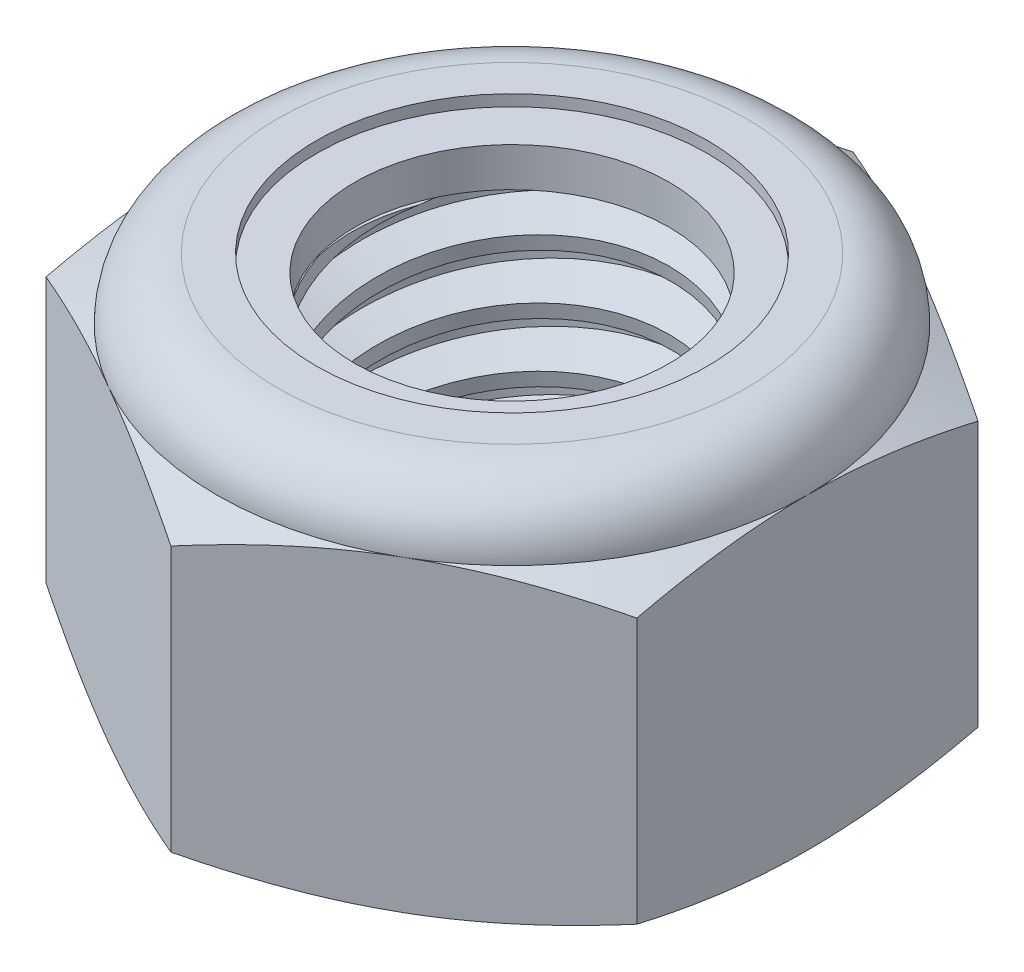
from build123d import *

# Parameters (mm, degrees)
EXTRUDE1_DEPTH      = 5
SKETCH2_W           = 2.5
SKETCH2_H           = 5
LPATTERN1_COUNT     = 6
LPATTERN1_PITCH     = 0.8
LPATTERN1_COL_COUNT = 2
LPATTERN1_COL_PITCH = 0.8


with BuildPart() as part:
    # Sketch1 → Extrude1 (new body)
    with BuildSketch(Plane(origin=(0, 0, 0), x_dir=(1, 0, 0), z_dir=(0, 1, 0))):
        Polygon((0, 4.618802154), (-4, 2.309401077), (-4, -2.309401077), (0, -4.618802154), (4, -2.309401077), (4, 2.309401077), align=None)
    extrude(amount=EXTRUDE1_DEPTH)

    # Sketch4 → Cut-Revolve2 (revolve, cut)
    with BuildSketch(Plane(origin=(0, 0, 0), x_dir=(0, 0, -1), z_dir=(1, 0, 0)), mode=Mode.PRIVATE) as cut_revolve2_sk:
        Polygon((0, 5), (2.5, 5), (2.127722339, 4.826404076), (2.127722339, 0.173595924), (2.5, 0), (0, 0), align=None)
    revolve(cut_revolve2_sk.sketch.rotate(Axis((0, 5, 0), (0, 1, 0)), 55.091745584), axis=Axis((0, 5, 0), (0, 1, 0)), mode=Mode.SUBTRACT)


with BuildPart() as body_2:
    # Sketch2 → Revolve1 (revolve)
    with BuildSketch(Plane(origin=(0, 0, 0), x_dir=(0, 0, -1), z_dir=(1, 0, 0))):
        with Locations((1.25, 2.5)):
            Rectangle(SKETCH2_W, SKETCH2_H)
    revolve(axis=Axis((0, -2.5, 0), (0, 1, 0)))

    # Sketch3 → Cut-Revolve1 (revolve, cut)
    with BuildSketch(Plane(origin=(0, 0, 0), x_dir=(0, 0, -1), z_dir=(1, 0, 0)), mode=Mode.PRIVATE) as cut_revolve1_sk:
        Polygon((2.51579905, 4.901255937), (2.626392401, 4.210047494), (2.15932044, 4.388495759), (2.127722339, 4.585983885), align=None)
    cut_revolve1 = revolve(cut_revolve1_sk.sketch.rotate(Axis((0, 5, 0.136915776), (0, -0.9874406319167054, -0.157990501106673)), 180), axis=Axis((0, 5, 0.136915776), (0, -0.9874406319167054, -0.157990501106673)), mode=Mode.SUBTRACT)

    # LPattern1: Cut-Revolve1 ×6
    with Locations(*[(0, -i * LPATTERN1_PITCH, 0) for i in range(1, LPATTERN1_COUNT)]):
        add(cut_revolve1, mode=Mode.SUBTRACT)

    # LPattern1 col: Cut-Revolve1 ×2
    with Locations(*[(0, i * LPATTERN1_COL_PITCH, 0) for i in range(1, LPATTERN1_COL_COUNT)]):
        add(cut_revolve1, mode=Mode.SUBTRACT)


with BuildPart() as part_1:
    add(part.part)

    # Combine1: cut body 2
    add(body_2.part, mode=Mode.SUBTRACT)

    # Sketch5 → Cut-Revolve3 (revolve, cut)
    with BuildSketch(Plane(origin=(0, 0, 0), x_dir=(0, 0, -1), z_dir=(1, 0, 0)), mode=Mode.PRIVATE) as cut_revolve3_sk:
        with BuildLine():
            Line((0, 0), (4, 0))
            Line((4, 0), (4.618802154, 0.288552183))
            Line((4.618802154, 0.288552183), (4.618802154, 3.878114484))
            Line((4.618802154, 3.878114484), (4, 4.166666667))
            ThreePointArc((4, 4.166666667), (3.755922318, 4.755922318), (3.166666667, 5))
            Line((3.166666667, 5), (3.166666667, 6.27))
            Line((3.166666667, 6.27), (5.888802154, 6.27))
            Line((5.888802154, 6.27), (5.888802154, -1.27))
            Line((5.888802154, -1.27), (0, -1.27))
            Line((0, -1.27), (0, 0))
        make_face()
    revolve(cut_revolve3_sk.sketch.rotate(Axis((0, 0, 0), (0, 1, 0)), 55.091745584), axis=Axis((0, 0, 0), (0, 1, 0)), mode=Mode.SUBTRACT)

    # Sketch6 → Cut-Revolve4 (revolve, cut)
    with BuildSketch(Plane(origin=(0, 0, 0), x_dir=(0, 0, -1), z_dir=(1, 0, 0)), mode=Mode.PRIVATE) as cut_revolve4_sk:
        with BuildLine():
            Line((0, 4.166666667), (3.8476, 4.166666667))
            ThreePointArc((3.8476, 4.166666667), (3.648159244, 4.648159244), (3.166666667, 4.8476))
            Line((3.166666667, 4.8476), (2.647194503, 4.8476))
            Line((2.647194503, 4.8476), (2.647194503, 6.27))
            Line((2.647194503, 6.27), (0, 6.27))
            Line((0, 6.27), (0, 4.166666667))
        make_face()
    revolve(cut_revolve4_sk.sketch.rotate(Axis((0, 6.27, 0), (0, 1, 0)), 55.091745584), axis=Axis((0, 6.27, 0), (0, 1, 0)), mode=Mode.SUBTRACT)


with BuildPart() as body_2_2:
    # Sketch7 → Revolve2 (revolve)
    with BuildSketch(Plane(origin=(0, 0, 0), x_dir=(0, 0, -1), z_dir=(1, 0, 0))):
        with BuildLine():
            Line((2.127722339, 4.242866667), (3.766579964, 4.242866667))
            ThreePointArc((3.766579964, 4.242866667), (3.566430175, 4.620419399), (3.166666667, 4.7714))
            Line((3.166666667, 4.7714), (2.127722339, 4.7714))
            Line((2.127722339, 4.7714), (2.127722339, 4.242866667))
        make_face()
    revolve(axis=Axis((0, 4.242866667, 0), (0, 1, 0)))


solid = Compound([part_1.part, body_2_2.part])
